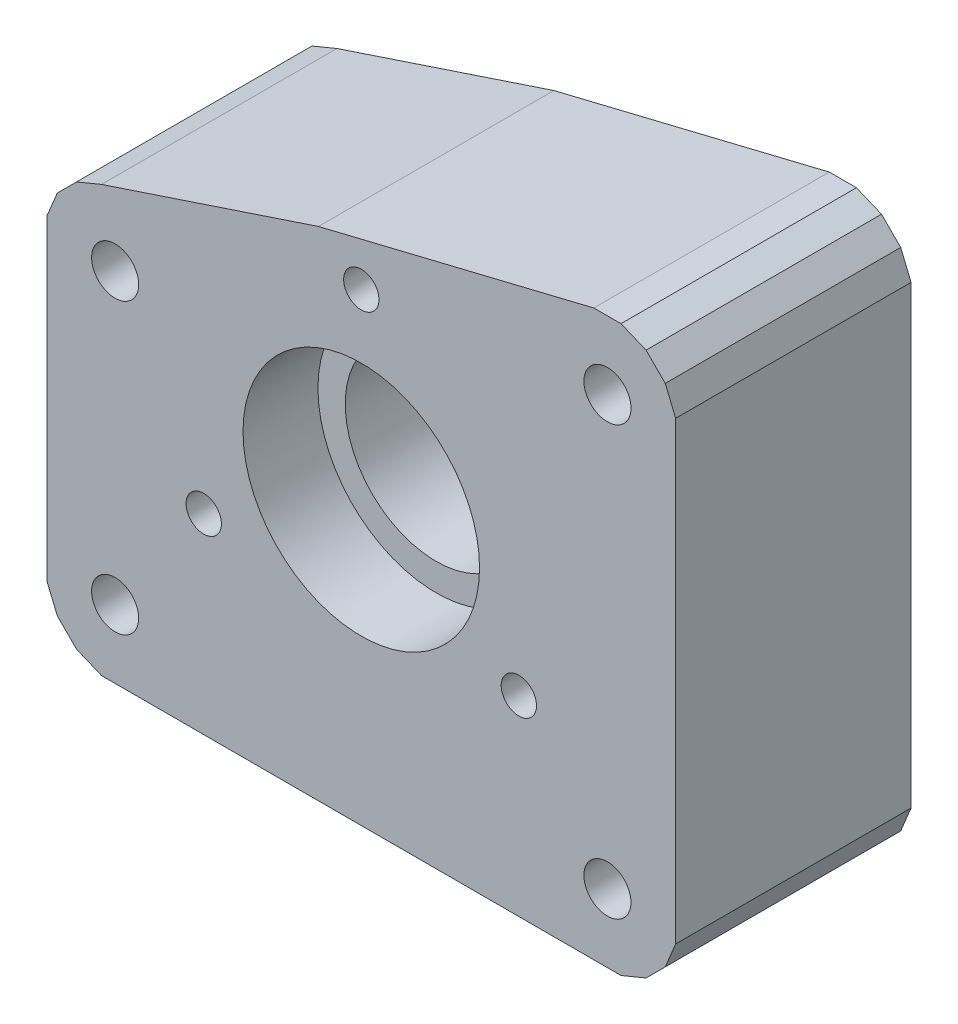
from build123d import *

# Parameters (mm, degrees)
CARTRIDGE_BODY_START    = 34
PROFILE_1_R             = 8.5
PROFILE_1_R_2           = 2.2
PROFILE_1_R_3           = 1.65
CARTRIDGE_BODY_DEPTH    = 22
INBOARD_608_SEAT_START  = 33.99
PROFILE_2_R             = 11.05
INBOARD_608_SEAT_DEPTH  = 7.01
OUTBOARD_608_SEAT_START = 49
PROFILE_3_R             = 11.05
OUTBOARD_608_SEAT_DEPTH = 7.01


with BuildPart() as part:
    # Profile_1 → Cartridge_body (new body)
    with BuildSketch(Plane.XY.offset(CARTRIDGE_BODY_START)):
        Polygon((-24.268087093, -26.375104323), (24.268087093, -26.375104323), (26.611206515, -25.40455248), (28.40455248, -23.611206515), (29.375104323, -21.268087093), (29.375104323, 21.268087093), (28.40455248, 23.611206515), (26.611206515, 25.40455248), (24.268087093, 26.375104323), (21.731912907, 26.375104323), (-3.999351601, 20.106098248), (-24.268087093, 13.375104323), (-26.611206515, 12.40455248), (-28.40455248, 10.611206515), (-29.375104323, 8.268087093), (-29.375104323, -21.268087093), (-28.40455248, -23.611206515), (-26.611206515, -25.40455248), align=None)
        Circle(PROFILE_1_R, mode=Mode.SUBTRACT)
        with Locations((-23, -20)):
            Circle(PROFILE_1_R_2, mode=Mode.SUBTRACT)
        with Locations((23, -20)):
            Circle(PROFILE_1_R_2, mode=Mode.SUBTRACT)
        with Locations((-23, 7)):
            Circle(PROFILE_1_R_2, mode=Mode.SUBTRACT)
        with Locations((23, 20)):
            Circle(PROFILE_1_R_2, mode=Mode.SUBTRACT)
        with Locations((0, 17)):
            Circle(PROFILE_1_R_3, mode=Mode.SUBTRACT)
        with Locations((-14.722431864, -8.5)):
            Circle(PROFILE_1_R_3, mode=Mode.SUBTRACT)
        with Locations((14.722431864, -8.5)):
            Circle(PROFILE_1_R_3, mode=Mode.SUBTRACT)
    extrude(amount=CARTRIDGE_BODY_DEPTH)

    # Profile_2 → Inboard_608_seat (cut)
    with BuildSketch(Plane.XY.offset(INBOARD_608_SEAT_START)):
        Circle(PROFILE_2_R)
    extrude(amount=INBOARD_608_SEAT_DEPTH, mode=Mode.SUBTRACT)

    # Profile_3 → Outboard_608_seat (cut)
    with BuildSketch(Plane.XY.offset(OUTBOARD_608_SEAT_START)):
        Circle(PROFILE_3_R)
    extrude(amount=OUTBOARD_608_SEAT_DEPTH, mode=Mode.SUBTRACT)


solid = part.part
